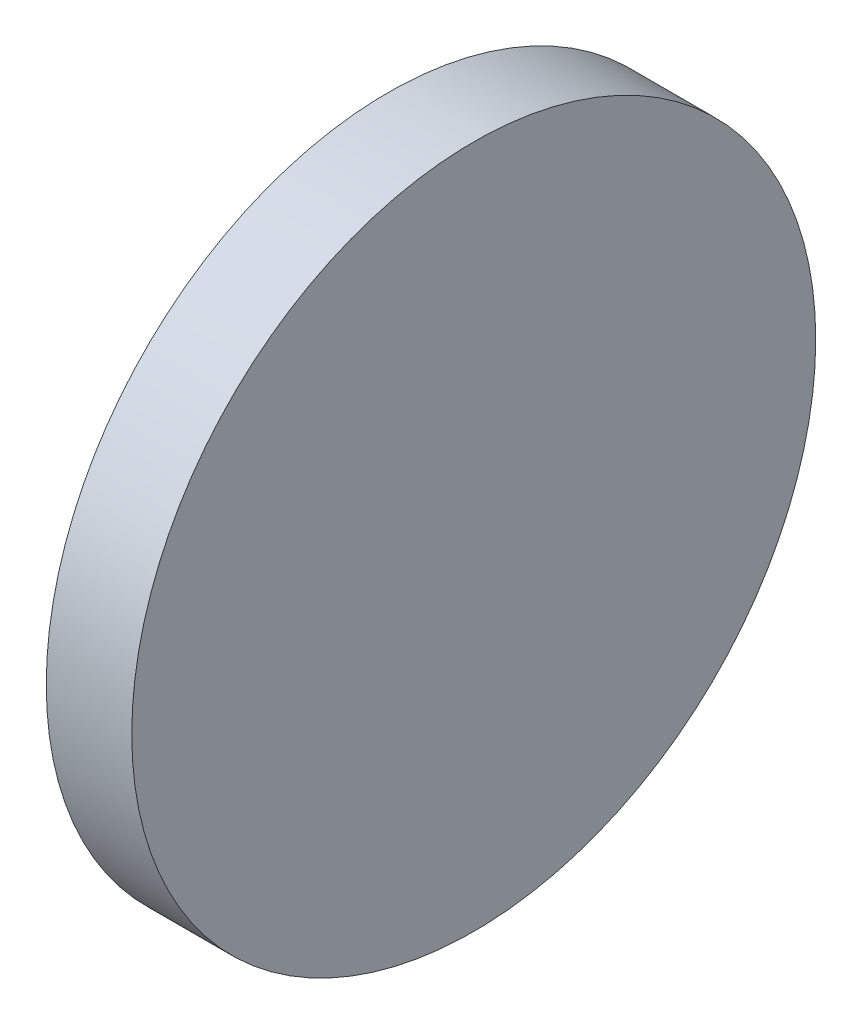
from build123d import *

# Parameters (mm, degrees)
SKETCH1_R           = 25.4
BOSS_EXTRUDE1_DEPTH = 6.35


with BuildPart() as part:
    # Sketch1 → Boss-Extrude1 (new body)
    with BuildSketch(Plane(origin=(0, 0, 0), x_dir=(0, 0, -1), z_dir=(1, 0, 0))):
        Circle(SKETCH1_R)
    extrude(amount=BOSS_EXTRUDE1_DEPTH)


solid = part.part
